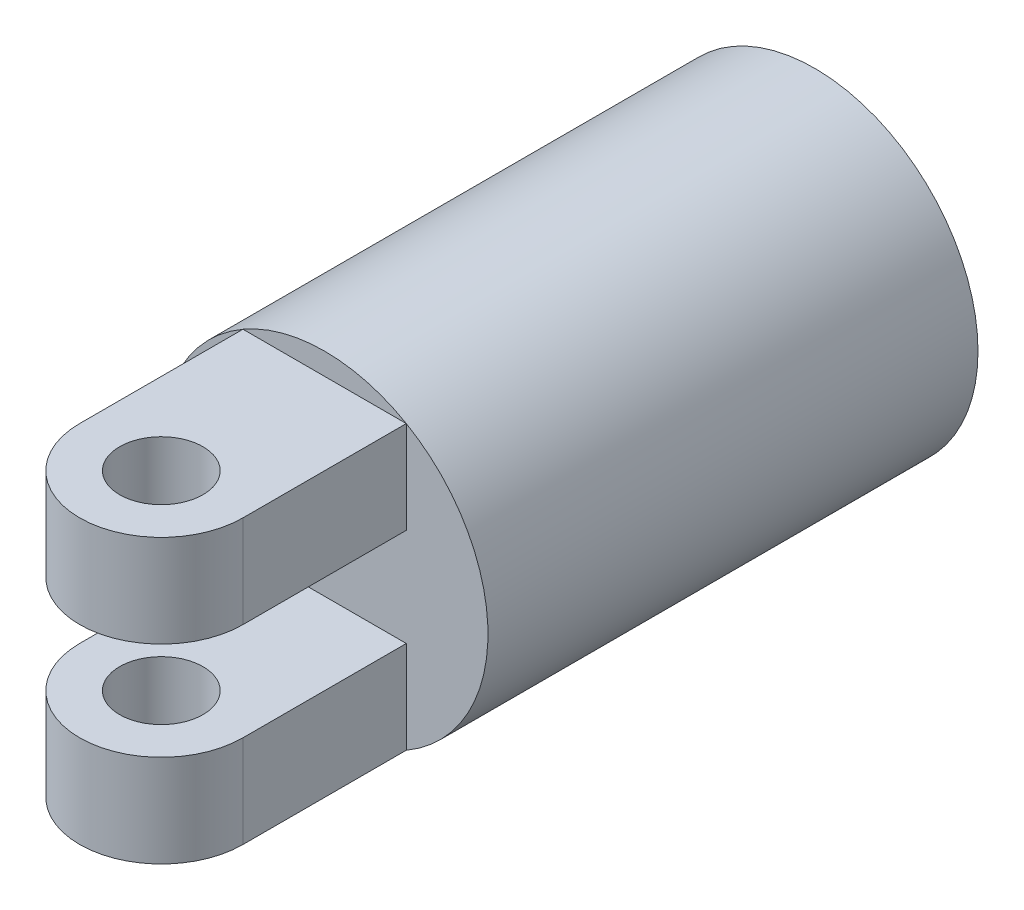
from build123d import *

# Parameters (mm, degrees)
SKETCH_1_R          = 10
EXTRUDE_1_DEPTH     = 30
SKETCH_2_W          = 10
SKETCH_2_H          = 17.320508075
EXTRUDE_3_DEPTH     = 15
CUT_EXTRUDE_1_DEPTH = 50.731328966
CUT_EXTRUDE_2_DEPTH = 50.731328966
CUT_EXTRUDE_3_DEPTH = 15
SKETCH_5_4_R        = 2.55
CUT_EXTRUDE_4_DEPTH = 50.731328966
SKETCH_9_R          = 5.05
CUT_EXTRUDE_5_DEPTH = 25


with BuildPart() as part:
    # Эскиз1 → Бобышка-Вытянуть1 (new body)
    with BuildSketch(Plane.XY):
        with Locations((0, 17.850182559)):
            Circle(SKETCH_1_R)
    extrude(amount=EXTRUDE_1_DEPTH)

    # Эскиз2 → Бобышка-Вытянуть3 (add)
    with BuildSketch(Plane.XY.offset(30)):
        with Locations((0, 17.85018256)):
            Rectangle(SKETCH_2_W, SKETCH_2_H)
    extrude(amount=EXTRUDE_3_DEPTH)

    # Эскиз5 → Вырез-Вытянуть1 (cut, through all)
    with BuildSketch(Plane(origin=(0, 26.510436597, 0), x_dir=(1, 0, 0), z_dir=(0, 1, 0))):
        with BuildLine():
            Line((5, -45), (5, -40))
            ThreePointArc((5, -40), (3.535533906, -43.535533906), (0, -45))
            Line((0, -45), (5, -45))
        make_face()
    extrude(amount=-CUT_EXTRUDE_1_DEPTH, mode=Mode.SUBTRACT)

    # Эскиз5<3> → Вырез-Вытянуть2 (cut, through all)
    with BuildSketch(Plane(origin=(0, 26.510436597, 0), x_dir=(1, 0, 0), z_dir=(0, 1, 0))):
        with BuildLine():
            ThreePointArc((0, -45), (-3.535533906, -43.535533906), (-5, -40))
            Line((-5, -40), (-5, -45))
            Line((-5, -45), (0, -45))
        make_face()
    extrude(amount=-CUT_EXTRUDE_2_DEPTH, mode=Mode.SUBTRACT)

    # Эскиз6 → Вырез-Вытянуть3 (cut)
    with BuildSketch(Plane(origin=(5, 0, 0), x_dir=(0, 0, -1), z_dir=(1, 0, 0))):
        Polygon((-40, 14.850182559), (-47.355991934, 14.850182559), (-47.355991934, 20.850182559), (-40, 20.850182559), (-30, 20.850182559), (-30, 14.850182559), align=None)
    extrude(amount=-CUT_EXTRUDE_3_DEPTH, mode=Mode.SUBTRACT)

    # Эскиз5<4> → Вырез-Вытянуть4 (cut, through all)
    with BuildSketch(Plane(origin=(0, 26.510436597, 0), x_dir=(1, 0, 0), z_dir=(0, 1, 0))):
        with Locations((0, -40)):
            Circle(SKETCH_5_4_R)
    extrude(amount=-CUT_EXTRUDE_4_DEPTH, mode=Mode.SUBTRACT)

    # Эскиз9 → Вырез-Вытянуть5 (cut)
    with BuildSketch(Plane(origin=(0, 0, 0), x_dir=(-1, 0, 0), z_dir=(0, 0, -1))):
        with Locations((0, 17.850182559)):
            Circle(SKETCH_9_R)
    extrude(amount=-CUT_EXTRUDE_5_DEPTH, mode=Mode.SUBTRACT)


solid = part.part
